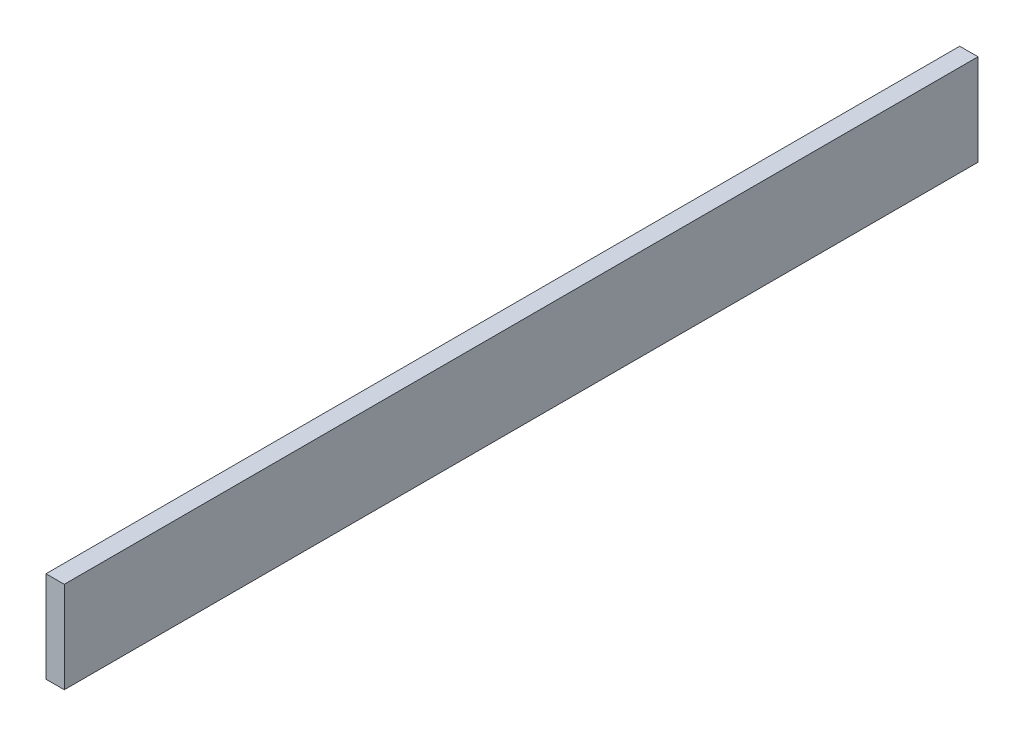
from build123d import *

# Parameters (mm, degrees)
SKETCH1_W           = 20
SKETCH1_H           = 100
BOSS_EXTRUDE1_DEPTH = 1000


with BuildPart() as part:
    # Sketch1 → Boss-Extrude1 (new body)
    with BuildSketch(Plane.XY):
        Rectangle(SKETCH1_W, SKETCH1_H)
    extrude(amount=BOSS_EXTRUDE1_DEPTH)


solid = part.part
